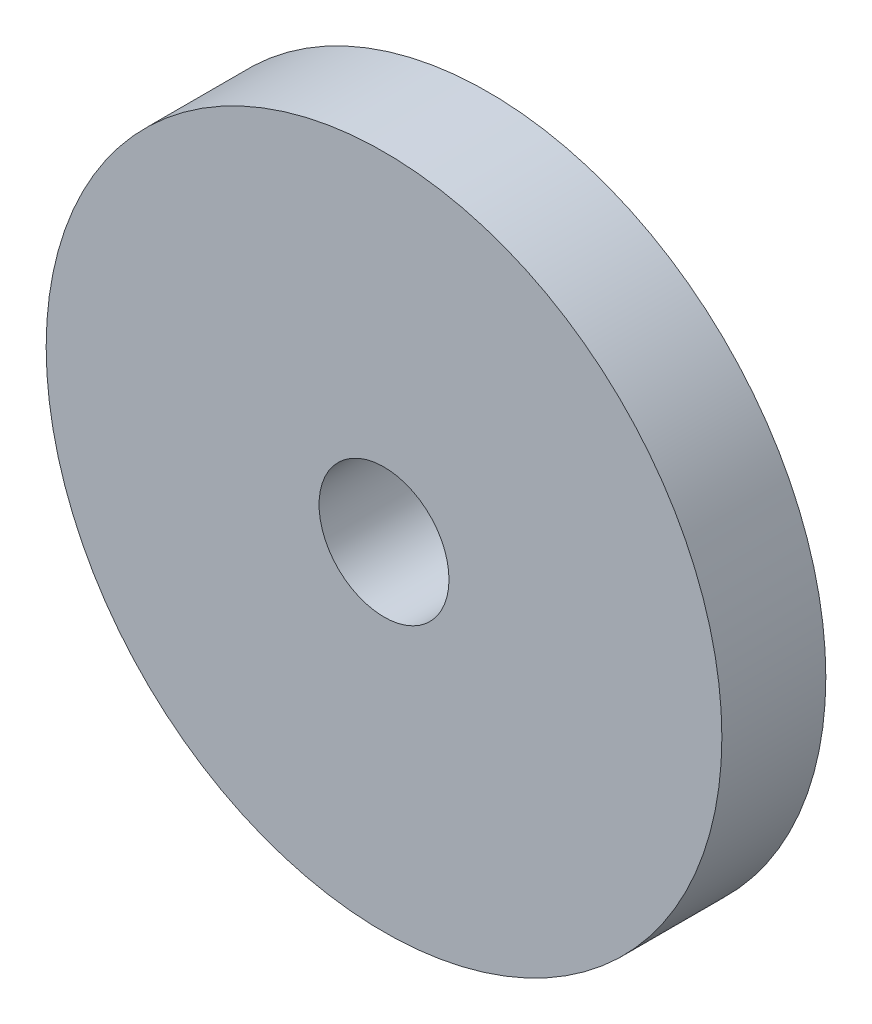
from build123d import *

# Parameters (mm, degrees)
SKETCH_8_R      = 130
SKETCH_8_R_2    = 25
EXTRUDE_1_DEPTH = 40


with BuildPart() as part:
    # 草图8 → 凸台-拉伸1 (new body)
    with BuildSketch(Plane.XY):
        Circle(SKETCH_8_R)
        Circle(SKETCH_8_R_2, mode=Mode.SUBTRACT)
    extrude(amount=EXTRUDE_1_DEPTH)


solid = part.part
